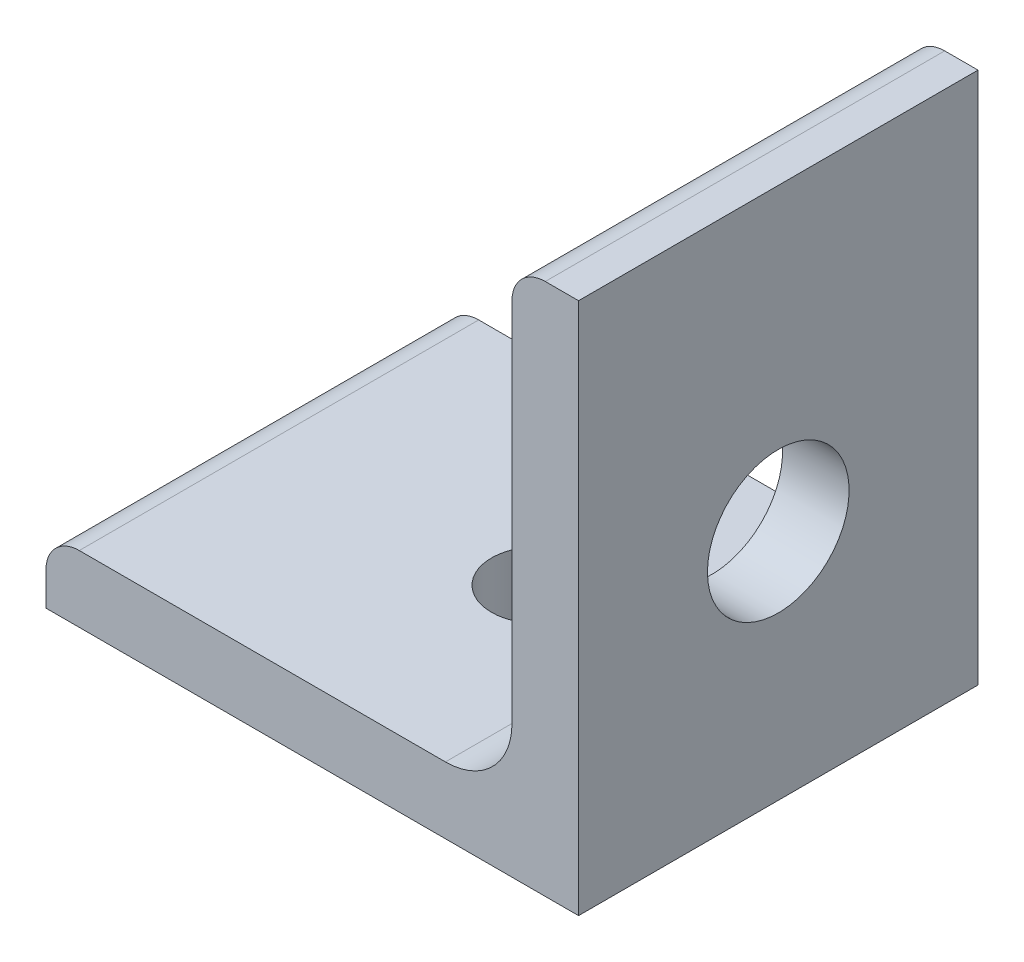
from build123d import *

# Parameters (mm, degrees)
BOSS_EXTRUDE1_DEPTH     = 9.525
F_1_4_CLEARANCE_HOLE1_D = 6.7564
F_8_CLEARANCE_HOLE1_D   = 4.4958


with BuildPart() as part:
    # Sketch2 → Boss-Extrude1 (new, symmetric)
    with BuildSketch(Plane.XY):
        with BuildLine():
            Line((-12.7, 0), (12.7, 0))
            Line((12.7, 0), (12.7, 25.4))
            Line((12.7, 25.4), (11.1125, 25.4))
            ThreePointArc((11.1125, 25.4), (9.989967985, 24.935032015), (9.525, 23.8125))
            Line((9.525, 23.8125), (9.525, 6.35))
            ThreePointArc((9.525, 6.35), (8.59506403, 4.10493597), (6.35, 3.175))
            Line((6.35, 3.175), (-11.1125, 3.175))
            ThreePointArc((-11.1125, 3.175), (-12.235032015, 2.710032015), (-12.7, 1.5875))
            Line((-12.7, 1.5875), (-12.7, 0))
        make_face()
    extrude(amount=BOSS_EXTRUDE1_DEPTH, both=True)

    # 1/4 Clearance Hole1 (through all)
    with Locations(Plane.ZY.offset(-9.525)):
        with Locations((0, 11.1166148)):
            Hole(F_1_4_CLEARANCE_HOLE1_D / 2)

    # #8 Clearance Hole1 (through all)
    with Locations(Plane(origin=(0, 3.175, 0), x_dir=(1, 0, 0), z_dir=(0, 1, 0))):
        with Locations((1.27, 0)):
            Hole(F_8_CLEARANCE_HOLE1_D / 2)


solid = part.part
